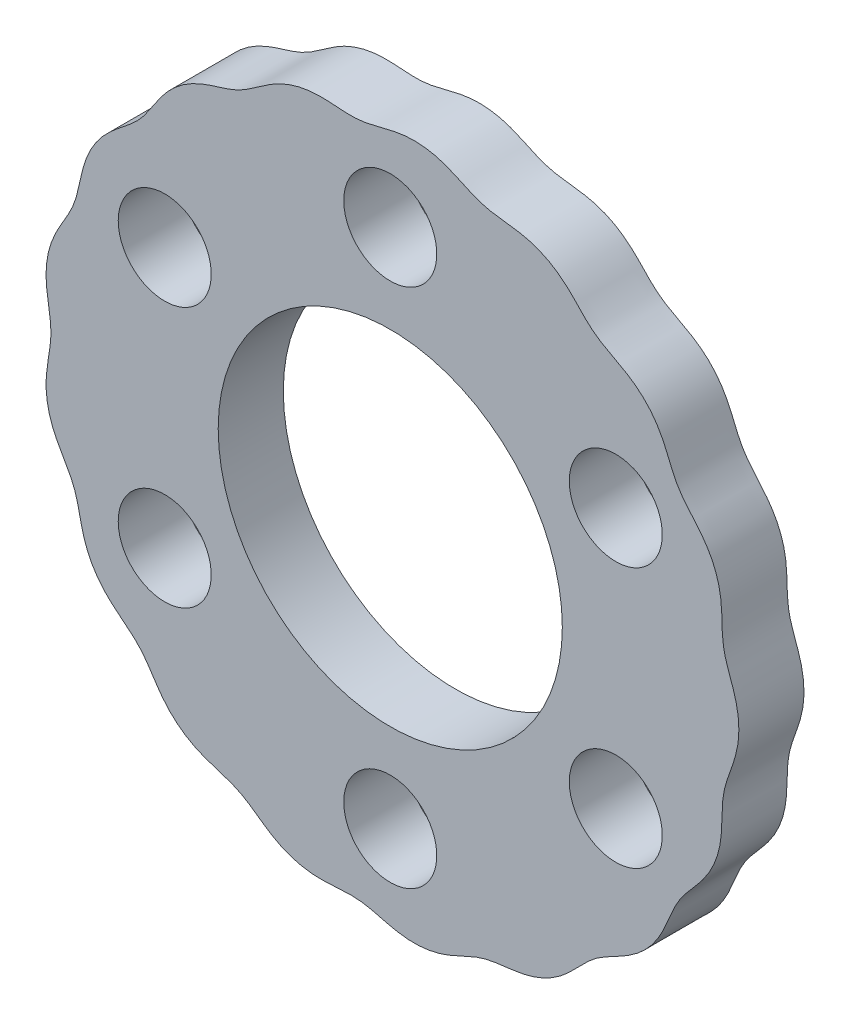
from build123d import *

# Parameters (mm, degrees)
BOSS_EXTRUDE1_DEPTH = 7
CUT_EXTRUDE2_REACH  = 55.383
SKETCH5_R           = 18.5
CUT_EXTRUDE3_REACH  = 55.383
SKETCH6_R           = 5


with BuildPart() as part:
    # Sketch2 → Boss-Extrude1 (new body)
    with BuildSketch(Plane.XY):
        with BuildLine():
            add(Edge.make_bspline(
                [(37.48, 0), (37.48, 0.075178242), (37.478322449, 0.22585947), (37.470705668, 0.452548867), (37.457778664, 0.680799205), (37.439240456, 0.911160311), (37.414772112, 1.143949805), (37.384089529, 1.379235209), (37.347008687, 1.616849603), (37.303476625, 1.856429261), (37.253598465, 2.097465255), (37.197642965, 2.339358747), (37.136020536, 2.581468839), (37.06927968, 2.823160752), (36.998076094, 3.063838358), (36.92314377, 3.302968371), (36.845282371, 3.540101233), (36.765323933, 3.774880375), (36.684111603, 4.007045523), (36.602490941, 4.236438618), (36.521282596, 4.462997257), (36.441274, 4.686753022), (36.363205353, 4.907824542), (36.28775931, 5.126409313), (36.215551358, 5.342775941), (36.147124421, 5.557253762), (36.082939498, 5.770222896), (36.023371399, 5.982103227), (35.968707527, 6.19334468), (35.919137395, 6.404414384), (35.874759384, 6.615787195), (35.835574051, 6.82793474), (35.801487369, 7.041314777), (35.772312327, 7.256362426), (35.747769521, 7.473478796), (35.727498797, 7.693022062), (35.711056157, 7.915298031), (35.697928433, 8.140551439), (35.687537583, 8.368957377), (35.679251369, 8.600612866), (35.672387324, 8.835529989), (35.66623616, 9.073630301), (35.66006021, 9.314739735), (35.653112028, 9.558585877), (35.644651555, 9.804796808), (35.633953524, 10.052902322), (35.620331131, 10.30233938), (35.603146701, 10.552460303), (35.581833793, 10.802546429), (35.555914545, 11.051827359), (35.525014044, 11.299508464), (35.488871798, 11.544804455), (35.447356629, 11.78698201), (35.400457685, 12.02540694), (35.348279119, 12.259597053), (35.291013733, 12.489270484), (35.228898686, 12.714382206), (35.162167805, 12.935142194), (35.090993895, 13.152004094), (35.01542917, 13.365617568), (34.935376671, 13.576754714), (34.850581775, 13.786214826), (34.760650329, 13.994724041), (34.665117474, 14.202857249), (34.563512478, 14.410981267), (34.455438306, 14.619235648), (34.340633842, 14.82754505), (34.219022112, 15.035659828), (34.090719386, 15.243203199), (33.956045778, 15.449732771), (33.815489892, 15.65478302), (33.669696693, 15.857915354), (33.519423033, 16.05874732), (33.365502857, 16.256970324), (33.208827585, 16.45237613), (33.050301587, 16.644847995), (32.890826318, 16.834370263), (32.731281668, 17.02102633), (32.572498367, 17.204983691), (32.415256579, 17.386497869), (32.260267267, 17.565895068), (32.108160873, 17.743561026), (31.959490238, 17.919937481), (31.814714523, 18.095501119), (31.674205492, 18.270760978), (31.538238747, 18.446239038), (31.406997708, 18.622464624), (31.280565039, 18.799953804), (31.15893923, 18.979210964), (31.042021361, 19.160706627), (30.929626045, 19.344872972), (30.821488519, 19.532096192), (30.717261188, 19.722700801), (30.616526948, 19.91694825), (30.518813274, 20.115030905), (30.423583002, 20.317057649), (30.330266006, 20.523057917), (30.238250813, 20.732967723), (30.146913256, 20.946633861), (30.055612243, 21.163804317), (29.963712362, 21.384131089), (29.870596225, 21.607170252), (29.775670238, 21.832380245), (29.678383537, 22.059130216), (29.57824677, 22.286708464), (29.474830679, 22.51432785), (29.367791555, 22.741145869), (29.256879822, 22.966283883), (29.141943818, 23.188850286), (29.022941092, 23.407975167), (28.899930846, 23.622845416), (28.773069162, 23.832749725), (28.642588668, 24.037123227), (28.508765381, 24.235589845), (28.371876034, 24.427996512), (28.23214737, 24.614431482), (28.089697834, 24.795213927), (27.944493701, 24.970857865), (27.796316611, 25.14200554), (27.644768057, 25.309343941), (27.489294013, 25.473507811), (27.329262793, 25.635011197), (27.164033854, 25.794183575), (26.993060069, 25.951165035), (26.81595148, 26.105910072), (26.632534111, 26.258235655), (26.442865382, 26.407867107), (26.247232129, 26.55449681), (26.046121262, 26.6978274), (25.840186716, 26.837617303), (25.630204925, 26.9737051), (25.417030711, 27.106024257), (25.201558612, 27.234608536), (24.984693579, 27.35960253), (24.767314825, 27.48123886), (24.550261514, 27.599848348), (24.334310167, 27.715834334), (24.12016192, 27.829667441), (23.908437645, 27.941876952), (23.699662064, 28.053024173), (23.494271806, 28.163709249), (23.292602625, 28.274539245), (23.094894993, 28.386127204), (22.901294179, 28.499077673), (22.711852922, 28.613974105), (22.526535054, 28.731367969), (22.345217613, 28.851764021), (22.167702942, 28.975621266), (21.99371614, 29.1033311), (21.822917519, 29.235216917), (21.65490991, 29.371527621), (21.489244435, 29.512427003), (21.32543501, 29.657996299), (21.162958206, 29.808218504), (21.001281895, 29.962995569), (20.839853542, 30.1221227), (20.678133867, 30.285308945), (20.515598553, 30.452168452), (20.351743292, 30.622214792), (20.186114769, 30.794884064), (20.018302446, 30.969519294), (19.847963546, 31.145392193), (19.674826235, 31.32170404), (19.498702947, 31.497603208), (19.319498683, 31.672198396), (19.137212054, 31.844575517), (18.951946773, 32.013828336), (18.763900024, 32.179078193), (18.573360197, 32.339511201), (18.380688849, 32.494412281), (18.186294272, 32.643200536), (17.990595376, 32.785464555), (17.793977611, 32.92099259), (17.596731366, 33.04977484), (17.399009086, 33.172011909), (17.200769228, 33.288070309), (17.001755566, 33.398431983), (16.801496227, 33.503618281), (16.599344717, 33.604113664), (16.394542446, 33.700286982), (16.1863175, 33.792358061), (15.973976109, 33.880376962), (15.756990189, 33.964249767), (15.535057808, 34.043785433), (15.308124571, 34.118740179), (15.076387482, 34.188888837), (14.840259851, 34.254058694), (14.600330729, 34.314165362), (14.357316574, 34.369245403), (14.112008153, 34.419443088), (13.865230834, 34.465029701), (13.617802274, 34.506377946), (13.370506519, 34.543964584), (13.124067272, 34.578337987), (12.879133733, 34.610117476), (12.636267598, 34.63997095), (12.395936191, 34.668594025), (12.158508735, 34.696701452), (11.924256566, 34.725015494), (11.693350585, 34.754240848), (11.465869266, 34.78506532), (11.241799243, 34.818141976), (11.02104344, 34.854073791), (10.803427432, 34.893416859), (10.588706187, 34.936657528), (10.376573289, 34.984215145), (10.166668061, 35.036422943), (9.958586963, 35.09353811), (9.75189071, 35.155720754), (9.546115339, 35.223044448), (9.340780586, 35.29547953), (9.135404579, 35.372912728), (8.929507087, 35.455121316), (8.72263052, 35.541804111), (8.514340976, 35.632557325), (8.304248285, 35.72689934), (8.092010401, 35.824262608), (7.877348413, 35.924008598), (7.660051257, 36.025424387), (7.439992914, 36.127749804), (7.217129978, 36.230168104), (6.991515531, 36.331834803), (6.763299933, 36.431884862), (6.532733192, 36.529452855), (6.300162253, 36.623693722), (6.066025367, 36.713807776), (5.830836002, 36.799060172), (5.595166236, 36.878818042), (5.359612703, 36.952566516), (5.124761113, 37.019939772), (4.891136457, 37.080736126), (4.659149338, 37.134923285), (4.429041421, 37.182627326), (4.200841768, 37.224109405), (3.974336027, 37.259705685), (3.749069812, 37.289770467), (3.52438319, 37.314607451), (3.299479947, 37.334411252), (3.073519557, 37.349222128), (2.8457201, 37.35894429), (2.615448418, 37.36335784), (2.382287491, 37.362172382), (2.146069359, 37.355108801), (1.906874291, 37.341935091), (1.665002975, 37.322530937), (1.420930863, 37.296908991), (1.175253657, 37.26523878), (0.928636876, 37.227825344), (0.681764221, 37.185123923), (0.435302402, 37.137697715), (0.189868895, 37.086206907), (-0.053991616, 37.031390213), (-0.295818193, 36.974028671), (-0.535247081, 36.914937016), (-0.772011608, 36.854939334), (-1.005946804, 36.794854766), (-1.236982681, 36.735479165), (-1.465142879, 36.677570647), (-1.690537113, 36.621844226), (-1.913354776, 36.568958203), (-2.133854298, 36.519501165), (-2.35235627, 36.473992976), (-2.56923111, 36.432868846), (-2.784890031, 36.396481873), (-2.999773794, 36.365091817), (-3.214342925, 36.338867424), (-3.429066444, 36.317884077), (-3.644411469, 36.302116009), (-3.860833427, 36.291443009), (-4.078765878, 36.285655968), (-4.298609982, 36.284451338), (-4.520725674, 36.287438796), (-4.745420723, 36.29415558), (-4.972942624, 36.304058185), (-5.203468233, 36.316545404), (-5.437097392, 36.330953239), (-5.673843427, 36.346579415), (-5.913629039, 36.362680187), (-6.156280498, 36.378494768), (-6.401525317, 36.393246009), (-6.648991244, 36.406166907), (-6.898208788, 36.416512868), (-7.148616915, 36.423573629), (-7.399573535, 36.426696749), (-7.650370765, 36.425311508), (-7.900259331, 36.418938595), (-8.14847732, 36.407208915), (-8.394290178, 36.389889067), (-8.637036148, 36.366865326), (-8.87617912, 36.338166158), (-9.111359177, 36.30392677), (-9.342438496, 36.26436516), (-9.569528805, 36.219733445), (-9.792995498, 36.170262351), (-10.013425677, 36.116099578), (-10.23156669, 36.057263992), (-10.44823604, 35.993618895), (-10.664220991, 35.92488019), (-10.880186452, 35.850654311), (-11.09660681, 35.770508426), (-11.313726684, 35.684036058), (-11.531558528, 35.59092948), (-11.749913042, 35.491037352), (-11.968441586, 35.384387607), (-12.186691982, 35.271198101), (-12.404163053, 35.151868852), (-12.620350054, 35.026956448), (-12.834784946, 34.897147037), (-13.047065135, 34.763225956), (-13.256868844, 34.626039905), (-13.463970493, 34.48647708), (-13.668242009, 34.3454352), (-13.869653604, 34.203800464), (-14.068273293, 34.06243373), (-14.264255916, 33.922147283), (-14.457837587, 33.783696641), (-14.649327636, 33.647769678), (-14.839096854, 33.514979821), (-15.027566269, 33.385854465), (-15.215197218, 33.260836718), (-15.402480239, 33.140278413), (-15.589918547, 33.024433104), (-15.778024426, 32.913466411), (-15.967300877, 32.807444468), (-16.158234543, 32.706343398), (-16.351282159, 32.610042688), (-16.546865361, 32.518340403), (-16.745355458, 32.430943733), (-16.947070201, 32.347487037), (-17.152261507, 32.267527085), (-17.361114088, 32.190568228), (-17.573729982, 32.116048899), (-17.790131053, 32.043373645), (-18.010247125, 31.971908306), (-18.233915289, 31.900996209), (-18.460877342, 31.82997818), (-18.690774738, 31.758187301), (-18.923153424, 31.684980711), (-19.157463116, 31.609742134), (-19.393064135, 31.531897812), (-19.629234216, 31.450930366), (-19.865184941, 31.36639858), (-20.100073037, 31.27794059), (-20.333030388, 31.18529869), (-20.563184694, 31.088310467), (-20.789705564, 30.986934693), (-21.011837084, 30.881229518), (-21.228950064, 30.771350299), (-21.440585647, 30.657522195), (-21.646498768, 30.54000654), (-21.846681397, 30.419049055), (-22.041373008, 30.294830044), (-22.231030795, 30.167404642), (-22.416283881, 30.036672561), (-22.597840854, 29.902345045), (-22.776407899, 29.76397582), (-22.952594104, 29.620998681), (-23.126845453, 29.472806626), (-23.299410392, 29.318836162), (-23.470337101, 29.158648648), (-23.639499062, 28.991988686), (-23.806645906, 28.818822544), (-23.971453074, 28.639341527), (-24.133580148, 28.453949191), (-24.292708494, 28.263226552), (-24.448584548, 28.067898619), (-24.601034032, 27.868788308), (-24.749982131, 27.666779978), (-24.895453359, 27.462783191), (-25.037576187, 27.257704858), (-25.176571959, 27.052421957), (-25.312747073, 26.847761178), (-25.446486917, 26.644487277), (-25.57824333, 26.443289952), (-25.708514362, 26.244770732), (-25.83784821, 26.049446626), (-25.966808745, 25.857733918), (-26.095988574, 25.669960486), (-26.22597238, 25.486352211), (-26.357342319, 25.307043398), (-26.490659454, 25.132076431), (-26.626449734, 24.961400879), (-26.765201524, 24.794885345), (-26.90734689, 24.632314536), (-27.053260735, 24.473402717), (-27.203247102, 24.317794255), (-27.357534231, 24.165073698), (-27.516271375, 24.014775924), (-27.679520016, 23.866392995), (-27.847252886, 23.719386211), (-28.019348929, 23.573196137), (-28.195596806, 23.427259198), (-28.375682416, 23.281007642), (-28.559203473, 23.133896382), (-28.745662591, 22.985405891), (-28.934469792, 22.835053417), (-29.124955637, 22.682414191), (-29.31637003, 22.527122869), (-29.507897914, 22.368888296), (-29.698674766, 22.207509146), (-29.887796174, 22.042870199), (-30.07434982, 21.874961722), (-30.257432782, 21.703869888), (-30.436186912, 21.529778425), (-30.609837742, 21.352961616), (-30.777725399, 21.173756115), (-30.93935143, 20.992539683), (-31.094402718, 20.809682202), (-31.242785499, 20.625504069), (-31.384616051, 20.440211464), (-31.520219057, 20.253857769), (-31.650062559, 20.066291666), (-31.774701201, 19.877152442), (-31.894691311, 19.685888147), (-32.010508884, 19.491805763), (-32.122487149, 19.294153412), (-32.230795615, 19.092218351), (-32.335433207, 18.885413882), (-32.436264207, 18.673351582), (-32.533070191, 18.455884013), (-32.625603894, 18.233113853), (-32.71363789, 18.005374122), (-32.797015737, 17.773196464), (-32.875667725, 17.537260117), (-32.949640003, 17.298347978), (-33.019084885, 17.057295855), (-33.084274413, 16.814956795), (-33.145575877, 16.572164421), (-33.20345086, 16.329708206), (-33.258434392, 16.088312996), (-33.311122116, 15.848624499), (-33.362157668, 15.611201133), (-33.412211979, 15.376504917), (-33.461971326, 15.144899466), (-33.512131545, 14.916651763), (-33.563369172, 14.691929019), (-33.616347381, 14.470807219), (-33.67168638, 14.253269508), (-33.729972892, 14.039218031), (-33.791728971, 13.828473794), (-33.857419322, 13.620789454), (-33.927438297, 13.415855713), (-34.00209503, 13.213306362), (-34.081622909, 13.012732609), (-34.166157731, 12.813686066), (-34.255749784, 12.615694415), (-34.350349384, 12.418266547), (-34.449815946, 12.220907192), (-34.553913678, 12.0231265), (-34.662310696, 11.824449482), (-34.774586211, 11.624430744), (-34.890235297, 11.422666009), (-35.008664619, 11.218798594), (-35.129214055, 11.012537324), (-35.251147184, 10.803658888), (-35.373673516, 10.592021542), (-35.495959898, 10.377574346), (-35.617134073, 10.160355972), (-35.736314316, 9.940507594), (-35.852621984, 9.718268319), (-35.965204596, 9.493972646), (-36.073265738, 9.268042443), (-36.176089048, 9.040970872), (-36.2730708, 8.813298171), (-36.363745836, 8.58557718), (-36.44781335, 8.358330429), (-36.525151031, 8.131998184), (-36.595812963, 7.906884094), (-36.660013296, 7.683103115), (-36.718086542, 7.460545144), (-36.770420525, 7.238857504), (-36.817397438, 7.017468789), (-36.859316247, 6.795637718), (-36.896343689, 6.572538941), (-36.928495128, 6.347360302), (-36.9556456, 6.119402507), (-36.977568583, 5.888156386), (-36.993997324, 5.653353931), (-37.004676875, 5.414980629), (-37.009434121, 5.173261626), (-37.008197779, 4.928621662), (-37.001038672, 4.681635897), (-36.988163487, 4.432975584), (-36.969916966, 4.183359196), (-36.946769912, 3.933508249), (-36.919294813, 3.684113395), (-36.888154821, 3.435806157), (-36.854072144, 3.189141922), (-36.817812925, 2.944587035), (-36.780173235, 2.702511003), (-36.741949827, 2.463184501), (-36.703934085, 2.226778683), (-36.666897124, 1.993367108), (-36.631568498, 1.762933137), (-36.598639187, 1.535372464), (-36.568737342, 1.310503499), (-36.542430196, 1.088073938), (-36.520207513, 0.867771442), (-36.502484036, 0.649232056), (-36.489587134, 0.432050865), (-36.481751935, 0.215792247), (-36.479125251, 0), (-36.481751935, -0.215792247), (-36.489587134, -0.432050865), (-36.502484036, -0.649232056), (-36.520207513, -0.867771442), (-36.542430196, -1.088073938), (-36.568737342, -1.310503499), (-36.598639187, -1.535372464), (-36.631568498, -1.762933137), (-36.666897124, -1.993367108), (-36.703934085, -2.226778683), (-36.741949827, -2.463184501), (-36.780173235, -2.702511003), (-36.817812925, -2.944587035), (-36.854072144, -3.189141922), (-36.888154821, -3.435806157), (-36.919294813, -3.684113395), (-36.946769912, -3.933508249), (-36.969916966, -4.183359196), (-36.988163487, -4.432975584), (-37.001038672, -4.681635897), (-37.008197779, -4.928621662), (-37.009434121, -5.173261626), (-37.004676875, -5.414980629), (-36.993997324, -5.653353931), (-36.977568583, -5.888156386), (-36.9556456, -6.119402507), (-36.928495128, -6.347360302), (-36.896343689, -6.572538941), (-36.859316247, -6.795637718), (-36.817397438, -7.017468789), (-36.770420525, -7.238857504), (-36.718086542, -7.460545144), (-36.660013296, -7.683103115), (-36.595812963, -7.906884094), (-36.525151031, -8.131998184), (-36.44781335, -8.358330429), (-36.363745836, -8.58557718), (-36.2730708, -8.813298171), (-36.176089048, -9.040970872), (-36.073265738, -9.268042443), (-35.965204596, -9.493972646), (-35.852621984, -9.718268319), (-35.736314316, -9.940507594), (-35.617134073, -10.160355972), (-35.495959898, -10.377574346), (-35.373673516, -10.592021542), (-35.251147184, -10.803658888), (-35.129214055, -11.012537324), (-35.008664619, -11.218798594), (-34.890235297, -11.422666009), (-34.774586211, -11.624430744), (-34.662310696, -11.824449482), (-34.553913678, -12.0231265), (-34.449815946, -12.220907192), (-34.350349384, -12.418266547), (-34.255749784, -12.615694415), (-34.166157731, -12.813686066), (-34.081622909, -13.012732609), (-34.00209503, -13.213306362), (-33.927438297, -13.415855713), (-33.857419322, -13.620789454), (-33.791728971, -13.828473794), (-33.729972892, -14.039218031), (-33.67168638, -14.253269508), (-33.616347381, -14.470807219), (-33.563369172, -14.691929019), (-33.512131545, -14.916651763), (-33.461971326, -15.144899466), (-33.412211979, -15.376504917), (-33.362157668, -15.611201133), (-33.311122116, -15.848624499), (-33.258434392, -16.088312996), (-33.20345086, -16.329708206), (-33.145575877, -16.572164421), (-33.084274413, -16.814956795), (-33.019084885, -17.057295855), (-32.949640003, -17.298347978), (-32.875667725, -17.537260117), (-32.797015737, -17.773196464), (-32.71363789, -18.005374122), (-32.625603894, -18.233113853), (-32.533070191, -18.455884013), (-32.436264207, -18.673351582), (-32.335433207, -18.885413882), (-32.230795615, -19.092218351), (-32.122487149, -19.294153412), (-32.010508884, -19.491805763), (-31.894691311, -19.685888147), (-31.774701201, -19.877152442), (-31.650062559, -20.066291666), (-31.520219057, -20.253857769), (-31.384616051, -20.440211464), (-31.242785499, -20.625504069), (-31.094402718, -20.809682202), (-30.93935143, -20.992539683), (-30.777725399, -21.173756115), (-30.609837742, -21.352961616), (-30.436186912, -21.529778425), (-30.257432782, -21.703869888), (-30.07434982, -21.874961722), (-29.887796174, -22.042870199), (-29.698674766, -22.207509146), (-29.507897914, -22.368888296), (-29.31637003, -22.527122869), (-29.124955637, -22.682414191), (-28.934469792, -22.835053417), (-28.745662591, -22.985405891), (-28.559203473, -23.133896382), (-28.375682416, -23.281007642), (-28.195596806, -23.427259198), (-28.019348929, -23.573196137), (-27.847252886, -23.719386211), (-27.679520016, -23.866392995), (-27.516271375, -24.014775924), (-27.357534231, -24.165073698), (-27.203247102, -24.317794255), (-27.053260735, -24.473402717), (-26.90734689, -24.632314536), (-26.765201524, -24.794885345), (-26.626449734, -24.961400879), (-26.490659454, -25.132076431), (-26.357342319, -25.307043398), (-26.22597238, -25.486352211), (-26.095988574, -25.669960486), (-25.966808745, -25.857733918), (-25.83784821, -26.049446626), (-25.708514362, -26.244770732), (-25.57824333, -26.443289952), (-25.446486917, -26.644487277), (-25.312747073, -26.847761178), (-25.176571959, -27.052421957), (-25.037576187, -27.257704858), (-24.895453359, -27.462783191), (-24.749982131, -27.666779978), (-24.601034032, -27.868788308), (-24.448584548, -28.067898619), (-24.292708494, -28.263226552), (-24.133580148, -28.453949191), (-23.971453074, -28.639341527), (-23.806645906, -28.818822544), (-23.639499062, -28.991988686), (-23.470337101, -29.158648648), (-23.299410392, -29.318836162), (-23.126845453, -29.472806626), (-22.952594104, -29.620998681), (-22.776407899, -29.76397582), (-22.597840854, -29.902345045), (-22.416283881, -30.036672561), (-22.231030795, -30.167404642), (-22.041373008, -30.294830044), (-21.846681397, -30.419049055), (-21.646498768, -30.54000654), (-21.440585647, -30.657522195), (-21.228950064, -30.771350299), (-21.011837084, -30.881229518), (-20.789705564, -30.986934693), (-20.563184694, -31.088310467), (-20.333030388, -31.18529869), (-20.100073037, -31.27794059), (-19.865184941, -31.36639858), (-19.629234216, -31.450930366), (-19.393064135, -31.531897812), (-19.157463116, -31.609742134), (-18.923153424, -31.684980711), (-18.690774738, -31.758187301), (-18.460877342, -31.82997818), (-18.233915289, -31.900996209), (-18.010247125, -31.971908306), (-17.790131053, -32.043373645), (-17.573729982, -32.116048899), (-17.361114088, -32.190568228), (-17.152261507, -32.267527085), (-16.947070201, -32.347487037), (-16.745355458, -32.430943733), (-16.546865361, -32.518340403), (-16.351282159, -32.610042688), (-16.158234543, -32.706343398), (-15.967300877, -32.807444468), (-15.778024426, -32.913466411), (-15.589918547, -33.024433104), (-15.402480239, -33.140278413), (-15.215197218, -33.260836718), (-15.027566269, -33.385854465), (-14.839096854, -33.514979821), (-14.649327636, -33.647769678), (-14.457837587, -33.783696641), (-14.264255916, -33.922147283), (-14.068273293, -34.06243373), (-13.869653604, -34.203800464), (-13.668242009, -34.3454352), (-13.463970493, -34.48647708), (-13.256868844, -34.626039905), (-13.047065135, -34.763225956), (-12.834784946, -34.897147037), (-12.620350054, -35.026956448), (-12.404163053, -35.151868852), (-12.186691982, -35.271198101), (-11.968441586, -35.384387607), (-11.749913042, -35.491037352), (-11.531558528, -35.59092948), (-11.313726684, -35.684036058), (-11.09660681, -35.770508426), (-10.880186452, -35.850654311), (-10.664220991, -35.92488019), (-10.44823604, -35.993618895), (-10.23156669, -36.057263992), (-10.013425677, -36.116099578), (-9.792995498, -36.170262351), (-9.569528805, -36.219733445), (-9.342438496, -36.26436516), (-9.111359177, -36.30392677), (-8.87617912, -36.338166158), (-8.637036148, -36.366865326), (-8.394290178, -36.389889067), (-8.14847732, -36.407208915), (-7.900259331, -36.418938595), (-7.650370765, -36.425311508), (-7.399573535, -36.426696749), (-7.148616915, -36.423573629), (-6.898208788, -36.416512868), (-6.648991244, -36.406166907), (-6.401525317, -36.393246009), (-6.156280498, -36.378494768), (-5.913629039, -36.362680187), (-5.673843427, -36.346579415), (-5.437097392, -36.330953239), (-5.203468233, -36.316545404), (-4.972942624, -36.304058185), (-4.745420723, -36.29415558), (-4.520725674, -36.287438796), (-4.298609982, -36.284451338), (-4.078765878, -36.285655968), (-3.860833427, -36.291443009), (-3.644411469, -36.302116009), (-3.429066444, -36.317884077), (-3.214342925, -36.338867424), (-2.999773794, -36.365091817), (-2.784890031, -36.396481873), (-2.56923111, -36.432868846), (-2.35235627, -36.473992976), (-2.133854298, -36.519501165), (-1.913354776, -36.568958203), (-1.690537113, -36.621844226), (-1.465142879, -36.677570647), (-1.236982681, -36.735479165), (-1.005946804, -36.794854766), (-0.772011608, -36.854939334), (-0.535247081, -36.914937016), (-0.295818193, -36.974028671), (-0.053991616, -37.031390213), (0.189868895, -37.086206907), (0.435302402, -37.137697715), (0.681764221, -37.185123923), (0.928636876, -37.227825344), (1.175253657, -37.26523878), (1.420930863, -37.296908991), (1.665002975, -37.322530937), (1.906874291, -37.341935091), (2.146069359, -37.355108801), (2.382287491, -37.362172382), (2.615448418, -37.36335784), (2.8457201, -37.35894429), (3.073519557, -37.349222128), (3.299479947, -37.334411252), (3.52438319, -37.314607451), (3.749069812, -37.289770467), (3.974336027, -37.259705685), (4.200841768, -37.224109405), (4.429041421, -37.182627326), (4.659149338, -37.134923285), (4.891136457, -37.080736126), (5.124761113, -37.019939772), (5.359612703, -36.952566516), (5.595166236, -36.878818042), (5.830836002, -36.799060172), (6.066025367, -36.713807776), (6.300162253, -36.623693722), (6.532733192, -36.529452855), (6.763299933, -36.431884862), (6.991515531, -36.331834803), (7.217129978, -36.230168104), (7.439992914, -36.127749804), (7.660051257, -36.025424387), (7.877348413, -35.924008598), (8.092010401, -35.824262608), (8.304248285, -35.72689934), (8.514340976, -35.632557325), (8.72263052, -35.541804111), (8.929507087, -35.455121316), (9.135404579, -35.372912728), (9.340780586, -35.29547953), (9.546115339, -35.223044448), (9.75189071, -35.155720754), (9.958586963, -35.09353811), (10.166668061, -35.036422943), (10.376573289, -34.984215145), (10.588706187, -34.936657528), (10.803427432, -34.893416859), (11.02104344, -34.854073791), (11.241799243, -34.818141976), (11.465869266, -34.78506532), (11.693350585, -34.754240848), (11.924256566, -34.725015494), (12.158508735, -34.696701452), (12.395936191, -34.668594025), (12.636267598, -34.63997095), (12.879133733, -34.610117476), (13.124067272, -34.578337987), (13.370506519, -34.543964584), (13.617802274, -34.506377946), (13.865230834, -34.465029701), (14.112008153, -34.419443088), (14.357316574, -34.369245403), (14.600330729, -34.314165362), (14.840259851, -34.254058694), (15.076387482, -34.188888837), (15.308124571, -34.118740179), (15.535057808, -34.043785433), (15.756990189, -33.964249767), (15.973976109, -33.880376962), (16.1863175, -33.792358061), (16.394542446, -33.700286982), (16.599344717, -33.604113664), (16.801496227, -33.503618281), (17.001755566, -33.398431983), (17.200769228, -33.288070309), (17.399009086, -33.172011909), (17.596731366, -33.04977484), (17.793977611, -32.92099259), (17.990595376, -32.785464555), (18.186294272, -32.643200536), (18.380688849, -32.494412281), (18.573360197, -32.339511201), (18.763900024, -32.179078193), (18.951946773, -32.013828336), (19.137212054, -31.844575517), (19.319498683, -31.672198396), (19.498702947, -31.497603208), (19.674826235, -31.32170404), (19.847963546, -31.145392193), (20.018302446, -30.969519294), (20.186114769, -30.794884064), (20.351743292, -30.622214792), (20.515598553, -30.452168452), (20.678133867, -30.285308945), (20.839853542, -30.1221227), (21.001281895, -29.962995569), (21.162958206, -29.808218504), (21.32543501, -29.657996299), (21.489244435, -29.512427003), (21.65490991, -29.371527621), (21.822917519, -29.235216917), (21.99371614, -29.1033311), (22.167702942, -28.975621266), (22.345217613, -28.851764021), (22.526535054, -28.731367969), (22.711852922, -28.613974105), (22.901294179, -28.499077673), (23.094894993, -28.386127204), (23.292602625, -28.274539245), (23.494271806, -28.163709249), (23.699662064, -28.053024173), (23.908437645, -27.941876952), (24.12016192, -27.829667441), (24.334310167, -27.715834334), (24.550261514, -27.599848348), (24.767314825, -27.48123886), (24.984693579, -27.35960253), (25.201558612, -27.234608536), (25.417030711, -27.106024257), (25.630204925, -26.9737051), (25.840186716, -26.837617303), (26.046121262, -26.6978274), (26.247232129, -26.55449681), (26.442865382, -26.407867107), (26.632534111, -26.258235655), (26.81595148, -26.105910072), (26.993060069, -25.951165035), (27.164033854, -25.794183575), (27.329262793, -25.635011197), (27.489294013, -25.473507811), (27.644768057, -25.309343941), (27.796316611, -25.14200554), (27.944493701, -24.970857865), (28.089697834, -24.795213927), (28.23214737, -24.614431482), (28.371876034, -24.427996512), (28.508765381, -24.235589845), (28.642588668, -24.037123227), (28.773069162, -23.832749725), (28.899930846, -23.622845416), (29.022941092, -23.407975167), (29.141943818, -23.188850286), (29.256879822, -22.966283883), (29.367791555, -22.741145869), (29.474830679, -22.51432785), (29.57824677, -22.286708464), (29.678383537, -22.059130216), (29.775670238, -21.832380245), (29.870596225, -21.607170252), (29.963712362, -21.384131089), (30.055612243, -21.163804317), (30.146913256, -20.946633861), (30.238250813, -20.732967723), (30.330266006, -20.523057917), (30.423583002, -20.317057649), (30.518813274, -20.115030905), (30.616526948, -19.91694825), (30.717261188, -19.722700801), (30.821488519, -19.532096192), (30.929626045, -19.344872972), (31.042021361, -19.160706627), (31.15893923, -18.979210964), (31.280565039, -18.799953804), (31.406997708, -18.622464624), (31.538238747, -18.446239038), (31.674205492, -18.270760978), (31.814714523, -18.095501119), (31.959490238, -17.919937481), (32.108160873, -17.743561026), (32.260267267, -17.565895068), (32.415256579, -17.386497869), (32.572498367, -17.204983691), (32.731281668, -17.02102633), (32.890826318, -16.834370263), (33.050301587, -16.644847995), (33.208827585, -16.45237613), (33.365502857, -16.256970324), (33.519423033, -16.05874732), (33.669696693, -15.857915354), (33.815489892, -15.65478302), (33.956045778, -15.449732771), (34.090719386, -15.243203199), (34.219022112, -15.035659828), (34.340633842, -14.82754505), (34.455438306, -14.619235648), (34.563512478, -14.410981267), (34.665117474, -14.202857249), (34.760650329, -13.994724041), (34.850581775, -13.786214826), (34.935376671, -13.576754714), (35.01542917, -13.365617568), (35.090993895, -13.152004094), (35.162167805, -12.935142194), (35.228898686, -12.714382206), (35.291013733, -12.489270484), (35.348279119, -12.259597053), (35.400457685, -12.02540694), (35.447356629, -11.78698201), (35.488871798, -11.544804455), (35.525014044, -11.299508464), (35.555914545, -11.051827359), (35.581833793, -10.802546429), (35.603146701, -10.552460303), (35.620331131, -10.30233938), (35.633953524, -10.052902322), (35.644651555, -9.804796808), (35.653112028, -9.558585877), (35.66006021, -9.314739735), (35.66623616, -9.073630301), (35.672387324, -8.835529989), (35.679251369, -8.600612866), (35.687537583, -8.368957377), (35.697928433, -8.140551439), (35.711056157, -7.915298031), (35.727498797, -7.693022062), (35.747769521, -7.473478796), (35.772312327, -7.256362426), (35.801487369, -7.041314777), (35.835574051, -6.82793474), (35.874759384, -6.615787195), (35.919137395, -6.404414384), (35.968707527, -6.19334468), (36.023371399, -5.982103227), (36.082939498, -5.770222896), (36.147124421, -5.557253762), (36.215551358, -5.342775941), (36.28775931, -5.126409313), (36.363205353, -4.907824542), (36.441274, -4.686753022), (36.521282596, -4.462997257), (36.602490941, -4.236438618), (36.684111603, -4.007045523), (36.765323933, -3.774880375), (36.845282371, -3.540101233), (36.92314377, -3.302968371), (36.998076094, -3.063838358), (37.06927968, -2.823160752), (37.136020536, -2.581468839), (37.197642965, -2.339358747), (37.253598465, -2.097465255), (37.303476625, -1.856429261), (37.347008687, -1.616849603), (37.384089529, -1.379235209), (37.414772112, -1.143949805), (37.439240456, -0.911160311), (37.457778664, -0.680799205), (37.470705668, -0.452548867), (37.478322449, -0.22585947), (37.48, -0.075178242), (37.48, 0)],
                knots=[0, 0, 0, 0, 0.000957102, 0.001918338, 0.002887447, 0.003867432, 0.004860345, 0.005867197, 0.006887982, 0.007921793, 0.008967001, 0.010021416, 0.01108248, 0.012147431, 0.01321345, 0.01427776, 0.015337734, 0.016390971, 0.017435362, 0.018469111, 0.019490813, 0.020499461, 0.021494463, 0.022475681, 0.023443411, 0.02439839, 0.025341775, 0.026275118, 0.027200311, 0.028119535, 0.029035187, 0.02994978, 0.030865878, 0.031785986, 0.032712467, 0.033647456, 0.034592784, 0.03554994, 0.036520009, 0.03750365, 0.038501085, 0.03951209, 0.040536002, 0.041571743, 0.042617834, 0.043672426, 0.044733346, 0.045798154, 0.04686419, 0.047928661, 0.048988746, 0.050041711, 0.051085055, 0.05211667, 0.053135036, 0.054139402, 0.055129931, 0.056107817, 0.057075294, 0.058035513, 0.058992307, 0.059949846, 0.060912216, 0.061883052, 0.062865199, 0.063860529, 0.064869869, 0.065893041, 0.066928999, 0.067976005, 0.069031783, 0.070093741, 0.071159085, 0.072225, 0.073288728, 0.074347682, 0.075399504, 0.076442134, 0.077473853, 0.078493311, 0.079499581, 0.080492151, 0.081470951, 0.082436366, 0.083389201, 0.084330692, 0.085262449, 0.086186427, 0.087104842, 0.088020116, 0.088934791, 0.089851418, 0.090772488, 0.091700321, 0.092637008, 0.093584328, 0.094543696, 0.095516126, 0.096502198, 0.097502054, 0.098515397, 0.099541489, 0.100579176, 0.101626908, 0.102682785, 0.103744577, 0.104809796, 0.10587576, 0.106939662, 0.107998686, 0.109050127, 0.110091538, 0.111120907, 0.112136834, 0.113138715, 0.114126895, 0.115102756, 0.116068703, 0.117028021, 0.117984641, 0.118942742, 0.119906363, 0.120879013, 0.121863381, 0.122861153, 0.123872969, 0.124898497, 0.125936551, 0.12698528, 0.128042346, 0.129105105, 0.130170755, 0.131236482, 0.132299549, 0.13335741, 0.134407748, 0.13544857, 0.136478207, 0.137495395, 0.138499271, 0.139489403, 0.140465804, 0.141428926, 0.142379658, 0.143319305, 0.144249539, 0.145172365, 0.146090047, 0.14700503, 0.147919865, 0.148837098, 0.149759198, 0.150688452, 0.151626896, 0.152576249, 0.153537857, 0.154512667, 0.155501173, 0.156503444, 0.157519104, 0.158547336, 0.159586915, 0.160636236, 0.161693323, 0.16275591, 0.163821463, 0.164887269, 0.165950512, 0.167008389, 0.168058227, 0.169097645, 0.170124723, 0.17113819, 0.172137599, 0.173123477, 0.174097384, 0.1750619, 0.176020444, 0.17697702, 0.177935811, 0.178900792, 0.179875344, 0.180861983, 0.181862217, 0.182876501, 0.183904349, 0.184944437, 0.185994816, 0.187053085, 0.18811656, 0.189182429, 0.190247878, 0.19131021, 0.192366903, 0.193415695, 0.194454652, 0.195482178, 0.196497064, 0.197498536, 0.198486227, 0.19946024, 0.200421099, 0.201369773, 0.202307625, 0.203236398, 0.204158144, 0.205075169, 0.205989937, 0.206905014, 0.207822929, 0.208746133, 0.209676868, 0.210617122, 0.211568554, 0.212532436, 0.213509635, 0.214500578, 0.215505252, 0.216523202, 0.217553537, 0.218594963, 0.219645806, 0.22070404, 0.221767338, 0.222833135, 0.223898697, 0.224961193, 0.226017839, 0.227066002, 0.228103366, 0.229128111, 0.230139104, 0.231136059, 0.232119682, 0.233091718, 0.234054909, 0.235012806, 0.235969469, 0.236929076, 0.23789552, 0.238872049, 0.239861009, 0.240863716, 0.241880458, 0.242910581, 0.243952643, 0.2450046, 0.24606399, 0.247128089, 0.248194088, 0.249259182, 0.25032069, 0.251376147, 0.252423335, 0.253460381, 0.254485748, 0.255498317, 0.256497365, 0.257482628, 0.258454268, 0.259412892, 0.260359544, 0.261295659, 0.262223034, 0.263143774, 0.264060217, 0.264974857, 0.265890248, 0.266808926, 0.267733301, 0.26866558, 0.269607696, 0.270561245, 0.271527424, 0.272507031, 0.273500413, 0.274507477, 0.275527687, 0.276560086, 0.277603309, 0.278655609, 0.279714912, 0.280778845, 0.281844801, 0.282910027, 0.283971693, 0.285027026, 0.286073441, 0.28710869, 0.28813107, 0.289139582, 0.2901341, 0.291115523, 0.292085774, 0.293047752, 0.294005127, 0.29496201, 0.295922557, 0.296890565, 0.297869146, 0.298860467, 0.29986566, 0.300884834, 0.301917187, 0.302961157, 0.304014614, 0.30507504, 0.306139679, 0.307205717, 0.308270368, 0.309330984, 0.310385133, 0.311430662, 0.312465745, 0.313488924, 0.314499144, 0.315495767, 0.316478603, 0.317447886, 0.318404314, 0.319348991, 0.320283421, 0.321209467, 0.322129272, 0.323045213, 0.323959798, 0.32487559, 0.325795102, 0.326720717, 0.327654599, 0.328598629, 0.329554329, 0.330522834, 0.331504862, 0.332500674, 0.333510109, 0.334532552, 0.335566971, 0.336611934, 0.33766563, 0.33872593, 0.339790414, 0.340856448, 0.341921248, 0.342981997, 0.344035936, 0.345080529, 0.346113613, 0.347133595, 0.348139617, 0.349131734, 0.350111011, 0.351079567, 0.352040451, 0.352997433, 0.353954668, 0.354916268, 0.355885944, 0.356866643, 0.357860358, 0.35886804, 0.359889623, 0.36092416, 0.361969971, 0.363024851, 0.364086219, 0.365151314, 0.366217304, 0.367281432, 0.368341075, 0.369393849, 0.370437657, 0.371470734, 0.372491691, 0.373499547, 0.374493738, 0.375474152, 0.376441104, 0.377395367, 0.378338116, 0.379270923, 0.380195703, 0.38111465, 0.382030165, 0.382944779, 0.383861045, 0.384781465, 0.385708389, 0.386643937, 0.387589924, 0.388547816, 0.389518668, 0.39050312, 0.391501361, 0.392513146, 0.393537792, 0.394574186, 0.39562083, 0.396675854, 0.397737077, 0.39880203, 0.39986805, 0.400932345, 0.401992086, 0.403044552, 0.404087258, 0.405118127, 0.406135685, 0.40713922, 0.408128962, 0.409106168, 0.410073123, 0.411033027, 0.411989752, 0.412947459, 0.413910236, 0.414881667, 0.415864548, 0.416860689, 0.417870854, 0.418894816, 0.419931478, 0.420979065, 0.422035286, 0.423097516, 0.424162975, 0.425228837, 0.426292356, 0.427350949, 0.428402286, 0.429444318, 0.430475347, 0.431494051, 0.432499522, 0.433491281, 0.43446928, 0.43543393, 0.436386061, 0.437326928, 0.438258171, 0.439181757, 0.440099919, 0.441015088, 0.441929808, 0.44284663, 0.443768032, 0.444696335, 0.4456336, 0.446581592, 0.447541705, 0.448514924, 0.449501807, 0.450502473, 0.451516588, 0.452543401, 0.453581722, 0.454629988, 0.455686276, 0.456748343, 0.457813682, 0.458879604, 0.459943296, 0.461001949, 0.462052865, 0.463093616, 0.464122225, 0.465137332, 0.466138391, 0.467125798, 0.468101001, 0.469066455, 0.470025506, 0.470982094, 0.471940412, 0.472904471, 0.473877747, 0.474862866, 0.475861458, 0.4768741, 0.477900407, 0.478939146, 0.479988431, 0.481045906, 0.482108915, 0.483174647, 0.484240291, 0.485303121, 0.486360599, 0.487410433, 0.488450637, 0.489479574, 0.490495999, 0.491499073, 0.492488393, 0.493463994, 0.494426358, 0.495376401, 0.496315444, 0.497245183, 0.498167642, 0.499085095, 0.5, 0.500914905, 0.501832358, 0.502754817, 0.503684556, 0.504623599, 0.505573642, 0.506536006, 0.507511607, 0.508500927, 0.509504001, 0.510520426, 0.511549363, 0.512589567, 0.513639401, 0.514696879, 0.515759709, 0.516825353, 0.517891085, 0.518954094, 0.520011569, 0.521060854, 0.522099593, 0.5231259, 0.524138542, 0.525137134, 0.526122253, 0.527095529, 0.528059588, 0.529017906, 0.529974494, 0.530933545, 0.531898999, 0.532874202, 0.533861609, 0.534862668, 0.535877775, 0.536906384, 0.537947135, 0.538998051, 0.540056704, 0.541120396, 0.542186318, 0.543251657, 0.544313724, 0.545370012, 0.546418278, 0.547456599, 0.548483412, 0.549497527, 0.550498193, 0.551485076, 0.552458295, 0.553418408, 0.5543664, 0.555303665, 0.556231968, 0.55715337, 0.558070192, 0.558984912, 0.559900081, 0.560818243, 0.561741829, 0.562673072, 0.563613939, 0.56456607, 0.56553072, 0.566508719, 0.567500478, 0.568505949, 0.569524653, 0.570555682, 0.571597714, 0.572649051, 0.573707644, 0.574771163, 0.575837025, 0.576902484, 0.577964714, 0.579020935, 0.580068522, 0.581105184, 0.582129146, 0.583139311, 0.584135452, 0.585118333, 0.586089764, 0.587052541, 0.588010248, 0.588966973, 0.589926877, 0.590893832, 0.591871038, 0.59286078, 0.593864315, 0.594881873, 0.595912742, 0.596955448, 0.598007914, 0.599067655, 0.60013195, 0.60119797, 0.602262923, 0.603324146, 0.60437917, 0.605425814, 0.606462208, 0.607486854, 0.608498639, 0.60949688, 0.610481332, 0.611452184, 0.612410076, 0.613356063, 0.614291611, 0.615218535, 0.616138955, 0.617055221, 0.617969835, 0.61888535, 0.619804297, 0.620729077, 0.621661884, 0.622604633, 0.623558896, 0.624525848, 0.625506262, 0.626500453, 0.627508309, 0.628529266, 0.629562343, 0.630606151, 0.631658925, 0.632718568, 0.633782696, 0.634848686, 0.635913781, 0.636975149, 0.638030029, 0.63907584, 0.640110377, 0.64113196, 0.642139642, 0.643133357, 0.644114056, 0.645083732, 0.646045332, 0.647002567, 0.647959549, 0.648920433, 0.649888989, 0.650868266, 0.651860383, 0.652866405, 0.653886387, 0.654919471, 0.655964064, 0.657018003, 0.658078752, 0.659143552, 0.660209586, 0.66127407, 0.66233437, 0.663388066, 0.664433029, 0.665467448, 0.666489891, 0.667499326, 0.668495138, 0.669477166, 0.670445671, 0.671401371, 0.672345401, 0.673279283, 0.674204898, 0.67512441, 0.676040202, 0.676954787, 0.677870728, 0.678790533, 0.679716579, 0.680651009, 0.681595686, 0.682552114, 0.683521397, 0.684504233, 0.685500856, 0.686511076, 0.687534255, 0.688569338, 0.689614867, 0.690669016, 0.691729632, 0.692794283, 0.693860321, 0.69492496, 0.695985386, 0.697038843, 0.698082813, 0.699115166, 0.70013434, 0.701139533, 0.702130854, 0.703109435, 0.704077443, 0.70503799, 0.705994873, 0.706952248, 0.707914226, 0.708884477, 0.7098659, 0.710860418, 0.71186893, 0.71289131, 0.713926559, 0.714972974, 0.716028307, 0.717089973, 0.718155199, 0.719221155, 0.720285088, 0.721344391, 0.722396691, 0.723439914, 0.724472313, 0.725492523, 0.726499587, 0.727492969, 0.728472576, 0.729438755, 0.730392304, 0.73133442, 0.732266699, 0.733191074, 0.734109752, 0.735025143, 0.735939783, 0.736856226, 0.737776966, 0.738704341, 0.739640456, 0.740587108, 0.741545732, 0.742517372, 0.743502635, 0.744501683, 0.745514252, 0.746539619, 0.747576665, 0.748623853, 0.74967931, 0.750740818, 0.751805912, 0.752871911, 0.75393601, 0.7549954, 0.756047357, 0.757089419, 0.758119542, 0.759136284, 0.760138991, 0.761127951, 0.76210448, 0.763070924, 0.764030531, 0.764987194, 0.765945091, 0.766908282, 0.767880318, 0.768863941, 0.769860896, 0.770871889, 0.771896634, 0.772933998, 0.773982161, 0.775038807, 0.776101303, 0.777166865, 0.778232662, 0.77929596, 0.780354194, 0.781405037, 0.782446463, 0.783476798, 0.784494748, 0.785499422, 0.786490365, 0.787467564, 0.788431446, 0.789382878, 0.790323132, 0.791253867, 0.792177071, 0.793094986, 0.794010063, 0.794924831, 0.795841856, 0.796763602, 0.797692375, 0.798630227, 0.799578901, 0.80053976, 0.801513773, 0.802501464, 0.803502936, 0.804517822, 0.805545348, 0.806584305, 0.807633097, 0.80868979, 0.809752122, 0.810817571, 0.81188344, 0.812946915, 0.814005184, 0.815055563, 0.816095651, 0.817123499, 0.818137783, 0.819138017, 0.820124656, 0.821099208, 0.822064189, 0.82302298, 0.823979556, 0.8249381, 0.825902616, 0.826876523, 0.827862401, 0.82886181, 0.829875277, 0.830902355, 0.831941773, 0.832991611, 0.834049488, 0.835112731, 0.836178537, 0.83724409, 0.838306677, 0.839363764, 0.840413085, 0.841452664, 0.842480896, 0.843496556, 0.844498827, 0.845487333, 0.846462143, 0.847423751, 0.848373104, 0.849311548, 0.850240802, 0.851162902, 0.852080135, 0.85299497, 0.853909953, 0.854827635, 0.855750461, 0.856680695, 0.857620342, 0.858571074, 0.859534196, 0.860510597, 0.861500729, 0.862504605, 0.863521793, 0.86455143, 0.865592252, 0.86664259, 0.867700451, 0.868763518, 0.869829245, 0.870894895, 0.871957654, 0.87301472, 0.874063449, 0.875101503, 0.876127031, 0.877138847, 0.878136619, 0.879120987, 0.880093637, 0.881057258, 0.882015359, 0.882971979, 0.883931297, 0.884897244, 0.885873105, 0.886861285, 0.887863166, 0.888879093, 0.889908462, 0.890949873, 0.892001314, 0.893060338, 0.89412424, 0.895190204, 0.896255423, 0.897317215, 0.898373092, 0.899420824, 0.900458511, 0.901484603, 0.902497946, 0.903497802, 0.904483874, 0.905456304, 0.906415672, 0.907362992, 0.908299679, 0.909227512, 0.910148582, 0.911065209, 0.911979884, 0.912895158, 0.913813573, 0.914737551, 0.915669308, 0.916610799, 0.917563634, 0.918529049, 0.919507849, 0.920500419, 0.921506689, 0.922526147, 0.923557866, 0.924600496, 0.925652318, 0.926711272, 0.927775, 0.928840915, 0.929906259, 0.930968217, 0.932023995, 0.933071001, 0.934106959, 0.935130131, 0.936139471, 0.937134801, 0.938116948, 0.939087784, 0.940050154, 0.941007693, 0.941964487, 0.942924706, 0.943892183, 0.944870069, 0.945860598, 0.946864964, 0.94788333, 0.948914945, 0.949958289, 0.951011254, 0.952071339, 0.95313581, 0.954201846, 0.955266654, 0.956327574, 0.957382166, 0.958428257, 0.959463998, 0.96048791, 0.961498915, 0.96249635, 0.963479991, 0.96445006, 0.965407216, 0.966352544, 0.967287533, 0.968214014, 0.969134122, 0.97005022, 0.970964813, 0.971880465, 0.972799689, 0.973724882, 0.974658225, 0.97560161, 0.976556589, 0.977524319, 0.978505537, 0.979500539, 0.980509187, 0.981530889, 0.982564638, 0.983609029, 0.984662266, 0.98572224, 0.98678655, 0.987852569, 0.98891752, 0.989978584, 0.991032999, 0.992078207, 0.993112018, 0.994132803, 0.995139655, 0.996132568, 0.997112553, 0.998081662, 0.999042898, 1, 1, 1, 1], degree=3))
        make_face()
    extrude(amount=BOSS_EXTRUDE1_DEPTH)

    # Sketch5 → Cut-Extrude2 (cut, up to next)
    with BuildSketch(Plane(origin=(0, 0, 0), x_dir=(-1, 0, 0), z_dir=(0, 0, -1)), mode=Mode.PRIVATE) as cut_extrude2_sk1:
        Circle(SKETCH5_R)
    cut_extrude2_tool1 = extrude(cut_extrude2_sk1.sketch, amount=-CUT_EXTRUDE2_REACH, mode=Mode.PRIVATE) & part.part
    add(cut_extrude2_tool1.solids().sort_by_distance((0, 0, 0))[0], mode=Mode.SUBTRACT)

    # Sketch6 → Cut-Extrude3 (cut, up to next)
    with BuildSketch(Plane(origin=(0, 0, 0), x_dir=(-1, 0, 0), z_dir=(0, 0, -1)), mode=Mode.PRIVATE) as cut_extrude3_sk1:
        with Locations((0, 28)):
            Circle(SKETCH6_R)
    cut_extrude3_tool1 = extrude(cut_extrude3_sk1.sketch, amount=-CUT_EXTRUDE3_REACH, mode=Mode.PRIVATE) & part.part
    # Sketch6 → Cut-Extrude3 (cut, up to next)
    with BuildSketch(Plane(origin=(0, 0, 0), x_dir=(-1, 0, 0), z_dir=(0, 0, -1)), mode=Mode.PRIVATE) as cut_extrude3_sk2:
        with Locations((24.248711306, 14)):
            Circle(SKETCH6_R)
    cut_extrude3_tool2 = extrude(cut_extrude3_sk2.sketch, amount=-CUT_EXTRUDE3_REACH, mode=Mode.PRIVATE) & part.part
    # Sketch6 → Cut-Extrude3 (cut, up to next)
    with BuildSketch(Plane(origin=(0, 0, 0), x_dir=(-1, 0, 0), z_dir=(0, 0, -1)), mode=Mode.PRIVATE) as cut_extrude3_sk3:
        with Locations((24.248711306, -14)):
            Circle(SKETCH6_R)
    cut_extrude3_tool3 = extrude(cut_extrude3_sk3.sketch, amount=-CUT_EXTRUDE3_REACH, mode=Mode.PRIVATE) & part.part
    # Sketch6 → Cut-Extrude3 (cut, up to next)
    with BuildSketch(Plane(origin=(0, 0, 0), x_dir=(-1, 0, 0), z_dir=(0, 0, -1)), mode=Mode.PRIVATE) as cut_extrude3_sk4:
        with Locations((0, -28)):
            Circle(SKETCH6_R)
    cut_extrude3_tool4 = extrude(cut_extrude3_sk4.sketch, amount=-CUT_EXTRUDE3_REACH, mode=Mode.PRIVATE) & part.part
    # Sketch6 → Cut-Extrude3 (cut, up to next)
    with BuildSketch(Plane(origin=(0, 0, 0), x_dir=(-1, 0, 0), z_dir=(0, 0, -1)), mode=Mode.PRIVATE) as cut_extrude3_sk5:
        with Locations((-24.248711306, -14)):
            Circle(SKETCH6_R)
    cut_extrude3_tool5 = extrude(cut_extrude3_sk5.sketch, amount=-CUT_EXTRUDE3_REACH, mode=Mode.PRIVATE) & part.part
    # Sketch6 → Cut-Extrude3 (cut, up to next)
    with BuildSketch(Plane(origin=(0, 0, 0), x_dir=(-1, 0, 0), z_dir=(0, 0, -1)), mode=Mode.PRIVATE) as cut_extrude3_sk6:
        with Locations((-24.248711306, 14)):
            Circle(SKETCH6_R)
    cut_extrude3_tool6 = extrude(cut_extrude3_sk6.sketch, amount=-CUT_EXTRUDE3_REACH, mode=Mode.PRIVATE) & part.part
    add(cut_extrude3_tool1.solids().sort_by_distance((0, 28, 0))[0], mode=Mode.SUBTRACT)
    add(cut_extrude3_tool2.solids().sort_by_distance((-24.248711, 14, 0))[0], mode=Mode.SUBTRACT)
    add(cut_extrude3_tool3.solids().sort_by_distance((-24.248711, -14, 0))[0], mode=Mode.SUBTRACT)
    add(cut_extrude3_tool4.solids().sort_by_distance((0, -28, 0))[0], mode=Mode.SUBTRACT)
    add(cut_extrude3_tool5.solids().sort_by_distance((24.248711, -14, 0))[0], mode=Mode.SUBTRACT)
    add(cut_extrude3_tool6.solids().sort_by_distance((24.248711, 14, 0))[0], mode=Mode.SUBTRACT)


solid = part.part
